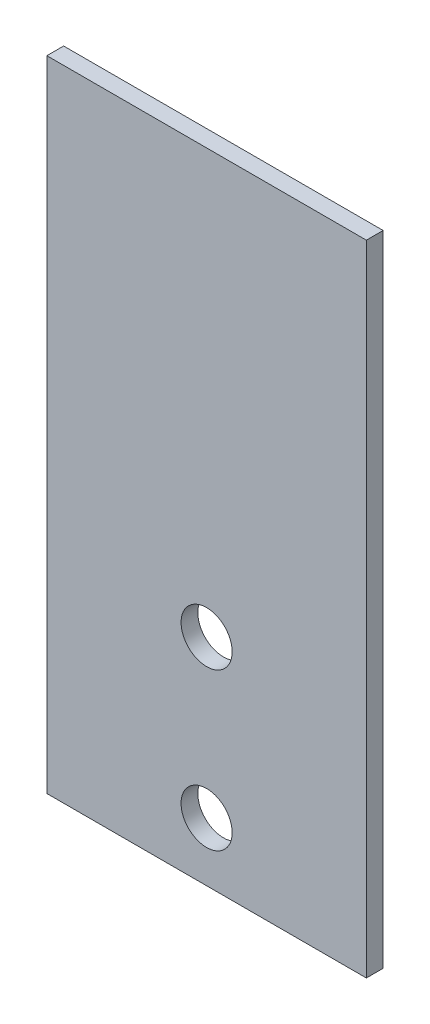
from build123d import *

# Parameters (mm, degrees)
SKETCH1_W           = 19.05
SKETCH1_H           = 38.1
SKETCH1_R           = 1.524
BOSS_EXTRUDE1_DEPTH = 1


with BuildPart() as part:
    # Sketch1 → Boss-Extrude1 (new body)
    with BuildSketch(Plane.XY):
        with Locations((0, 39.542)):
            Rectangle(SKETCH1_W, SKETCH1_H)
        with Locations((0, 33.332)):
            Circle(SKETCH1_R, mode=Mode.SUBTRACT)
        with Locations((0, 23.992)):
            Circle(SKETCH1_R, mode=Mode.SUBTRACT)
    extrude(amount=BOSS_EXTRUDE1_DEPTH)


solid = part.part
